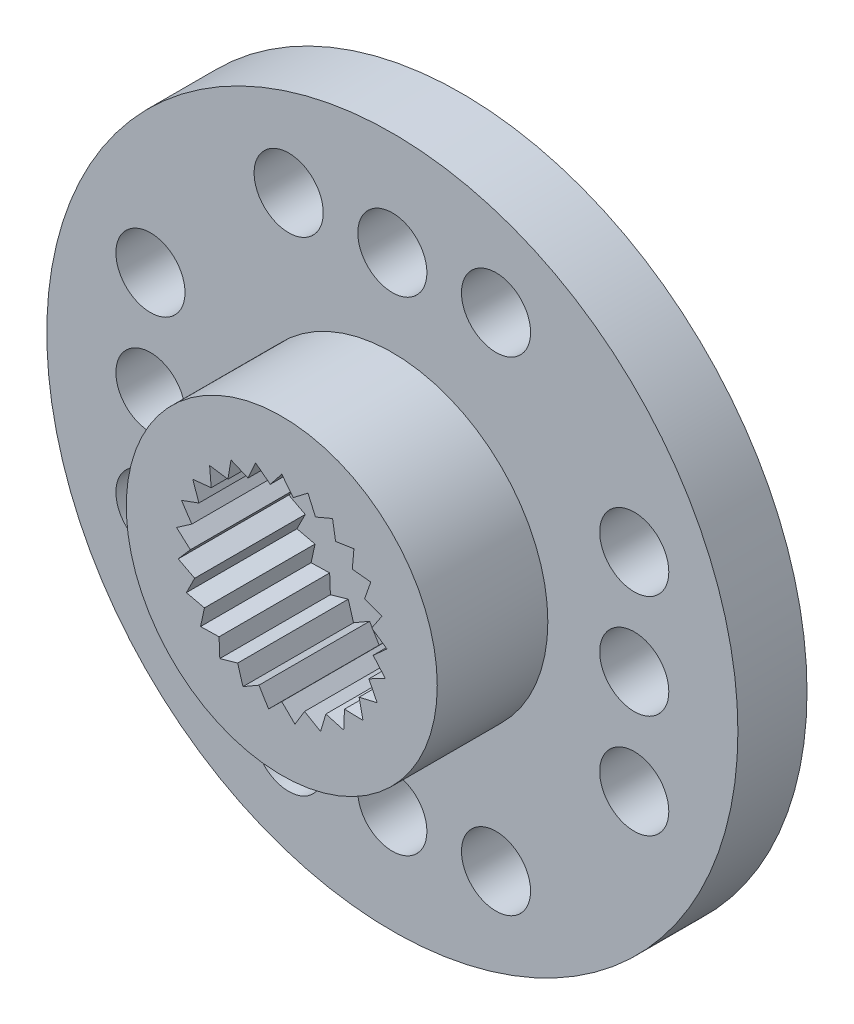
from build123d import *

# Parameters (mm, degrees)
SKETCH1_R           = 10
SKETCH1_R_2         = 1
BOSS_EXTRUDE1_DEPTH = 2
SKETCH2_R           = 4.5
BOSS_EXTRUDE2_DEPTH = 3.2
SKETCH4_R           = 1.5
CUT_EXTRUDE1_DEPTH  = 2


with BuildPart() as part:
    # Sketch1 → Boss-Extrude1 (new body)
    with BuildSketch(Plane.XY):
        Circle(SKETCH1_R)
        with Locations((0, 7)):
            Circle(SKETCH1_R_2, mode=Mode.SUBTRACT)
        with Locations((-3, 7)):
            Circle(SKETCH1_R_2, mode=Mode.SUBTRACT)
        with Locations((3, 7)):
            Circle(SKETCH1_R_2, mode=Mode.SUBTRACT)
        with Locations((7, 0)):
            Circle(SKETCH1_R_2, mode=Mode.SUBTRACT)
        with Locations((7, -3)):
            Circle(SKETCH1_R_2, mode=Mode.SUBTRACT)
        with Locations((7, 3)):
            Circle(SKETCH1_R_2, mode=Mode.SUBTRACT)
        with Locations((0, -7)):
            Circle(SKETCH1_R_2, mode=Mode.SUBTRACT)
        with Locations((-3, -7)):
            Circle(SKETCH1_R_2, mode=Mode.SUBTRACT)
        with Locations((3, -7)):
            Circle(SKETCH1_R_2, mode=Mode.SUBTRACT)
        with Locations((-7, 0)):
            Circle(SKETCH1_R_2, mode=Mode.SUBTRACT)
        with Locations((-7, 3)):
            Circle(SKETCH1_R_2, mode=Mode.SUBTRACT)
        with Locations((-7, -3)):
            Circle(SKETCH1_R_2, mode=Mode.SUBTRACT)
    extrude(amount=BOSS_EXTRUDE1_DEPTH)

    # Sketch2 → Boss-Extrude2 (add)
    with BuildSketch(Plane.XY.offset(2)):
        Circle(SKETCH2_R)
        Polygon((0.758504156, 2.954178641), (0.975530065, 2.463907688), (1.469348706, 2.672735374), (1.557630919, 2.143895035), (2.087868673, 2.223354314), (2.041860093, 1.689173573), (2.575200173, 1.634271725), (2.397791689, 1.128315123), (2.900722375, 0.942501833), (2.603061214, 0.496560484), (3.043981522, 0.191511085), (2.64477083, -0.166394877), (2.995976115, -0.571513009), (2.520299768, -0.818895035), (2.75972251, -1.298626839), (2.237469003, -1.419941007), (2.35006539, -1.944143169), (1.814049831, -1.931766863), (1.792745019, -2.467501833), (1.276647236, -2.322212702), (1.122779886, -2.835818282), (0.659028201, -2.566745377), (0.382266362, -3.025949839), (0, -2.65), (-0.382266362, -3.025949839), (-0.659028201, -2.566745377), (-1.122779886, -2.835818282), (-1.276647236, -2.322212702), (-1.792745019, -2.467501833), (-1.814049831, -1.931766863), (-2.35006539, -1.944143169), (-2.237469003, -1.419941007), (-2.75972251, -1.298626839), (-2.520299768, -0.818895035), (-2.995976115, -0.571513009), (-2.64477083, -0.166394877), (-3.043981522, 0.191511085), (-2.603061214, 0.496560484), (-2.900722375, 0.942501833), (-2.397791689, 1.128315123), (-2.575200173, 1.634271725), (-2.041860093, 1.689173573), (-2.087868673, 2.223354314), (-1.557630919, 2.143895035), (-1.469348706, 2.672735374), (-0.975530065, 2.463907688), (-0.758504156, 2.954178641), (-0.332133069, 2.629103958), (0, 3.05), (0.332133069, 2.629103958), align=None, mode=Mode.SUBTRACT)
    extrude(amount=BOSS_EXTRUDE2_DEPTH)

    # Sketch4 → Cut-Extrude1 (cut)
    with BuildSketch(Plane.XY.offset(2)):
        Circle(SKETCH4_R)
    extrude(amount=-CUT_EXTRUDE1_DEPTH, mode=Mode.SUBTRACT)


solid = part.part
